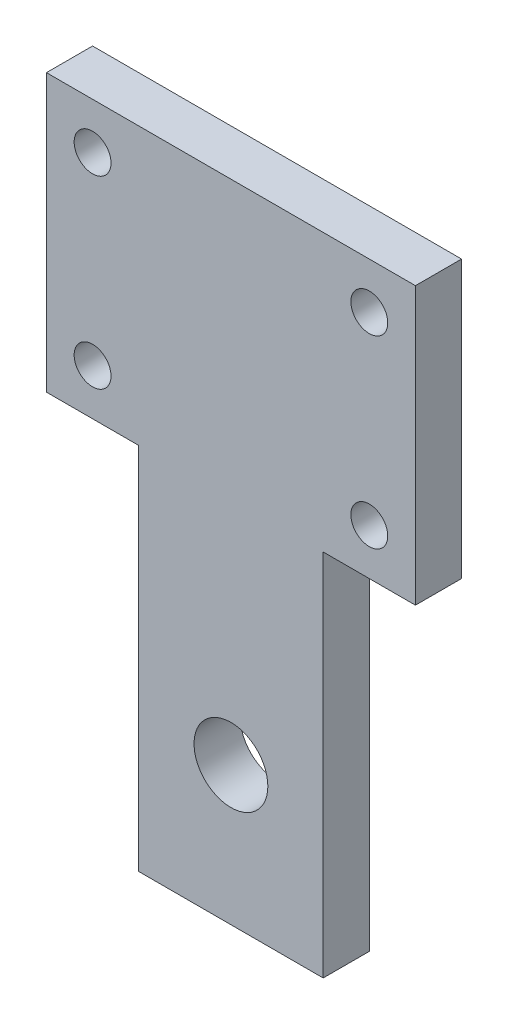
from build123d import *

# Parameters (mm, degrees)
BOSS_EXTRUDE1_DEPTH = 2.5
SKETCH2_R           = 2.5
SKETCH2_R_2         = 4
CUT_EXTRUDE1_DEPTH  = 46
SKETCH3_R           = 2
CUT_EXTRUDE2_DEPTH  = 10


with BuildPart() as part:
    # Sketch1 → Boss-Extrude1 (new, symmetric)
    with BuildSketch(Plane.XY):
        Polygon((-20, 30), (-20, 0), (-10, 0), (-10, -40), (10, -40), (10, 0), (20, 0), (20, 30), align=None)
    extrude(amount=BOSS_EXTRUDE1_DEPTH, both=True)

    # Sketch2 → Cut-Extrude1 (cut, through all)
    with BuildSketch(Plane.XY.offset(2.5)):
        with Locations((-25, 20)):
            Circle(SKETCH2_R)
        with Locations((25, 20)):
            Circle(SKETCH2_R)
        with Locations((0, -25)):
            Circle(SKETCH2_R_2)
    extrude(amount=-CUT_EXTRUDE1_DEPTH, mode=Mode.SUBTRACT)

    # Sketch3 → Cut-Extrude2 (cut)
    with BuildSketch(Plane.XY.offset(2.5)):
        with Locations((-15, 25)):
            Circle(SKETCH3_R)
        with Locations((15, 25)):
            Circle(SKETCH3_R)
        with Locations((15, 5)):
            Circle(SKETCH3_R)
        with Locations((-15, 5)):
            Circle(SKETCH3_R)
    extrude(amount=-CUT_EXTRUDE2_DEPTH, mode=Mode.SUBTRACT)


solid = part.part
